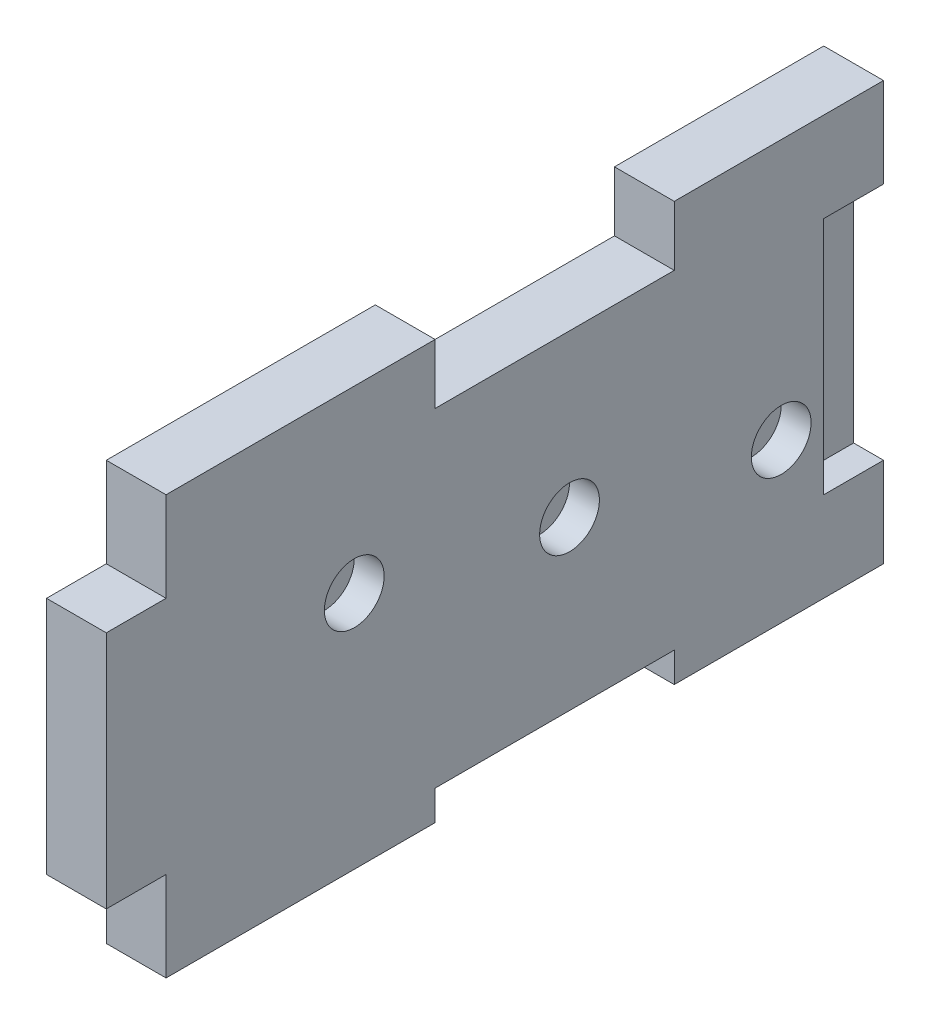
from build123d import *

# Parameters (mm, degrees)
BOSS_EXTRUDE1_DEPTH = 5
SKETCH5_R           = 5
CUT_EXTRUDE4_DEPTH  = 5
SKETCH2_R           = 5
CUT_EXTRUDE5_DEPTH  = 5
BOSS_EXTRUDE2_DEPTH = 5
SKETCH7_W           = 10
SKETCH7_H           = 40
CUT_EXTRUDE6_DEPTH  = 5


with BuildPart() as part:
    # Sketch1 → Boss-Extrude1 (new body)
    with BuildSketch(Plane(origin=(0, 0, 0), x_dir=(0, 0, -1), z_dir=(1, 0, 0))):
        Polygon((-75, 70), (-120, 70), (-120, 55), (-130, 55), (-130, 15), (-120, 15), (-120, 0), (-75, 0), (-75, 5), (-35, 5), (-35, 0), (-10, 0), (0, 0), (0, 15), (0, 55), (0, 70), (-10, 70), (-35, 70), (-35, 60), (-75, 60), align=None)
    extrude(amount=BOSS_EXTRUDE1_DEPTH)

    # Sketch5 → Cut-Extrude4 (cut)
    with BuildSketch(Plane.ZY):
        with Locations((17.111667647, 26.5)):
            Circle(SKETCH5_R)
        with Locations((52.52, 33)):
            Circle(SKETCH5_R)
    extrude(amount=-CUT_EXTRUDE4_DEPTH, mode=Mode.SUBTRACT)

    # Sketch2 → Cut-Extrude5 (cut)
    with BuildSketch(Plane(origin=(5, 0, 0), x_dir=(0, 0, -1), z_dir=(1, 0, 0))):
        with Locations((-88.52, 40)):
            Circle(SKETCH2_R)
    extrude(amount=-CUT_EXTRUDE5_DEPTH, mode=Mode.SUBTRACT)

    # Sketch6 → Boss-Extrude2 (add)
    with BuildSketch(Plane.ZY):
        Polygon((35, 0), (35, 5), (75, 5), (75, 0), (120, 0), (120, 15), (130, 15), (130, 55), (120, 55), (120, 70), (75, 70), (75, 60), (35, 60), (35, 70), (0, 70), (0, 0), align=None)
    extrude(amount=BOSS_EXTRUDE2_DEPTH)

    # Sketch7 → Cut-Extrude6 (cut)
    with BuildSketch(Plane(origin=(5, 0, 0), x_dir=(0, 0, -1), z_dir=(1, 0, 0))):
        with Locations((-5, 35)):
            Rectangle(SKETCH7_W, SKETCH7_H)
    extrude(amount=-CUT_EXTRUDE6_DEPTH, mode=Mode.SUBTRACT)


solid = part.part
